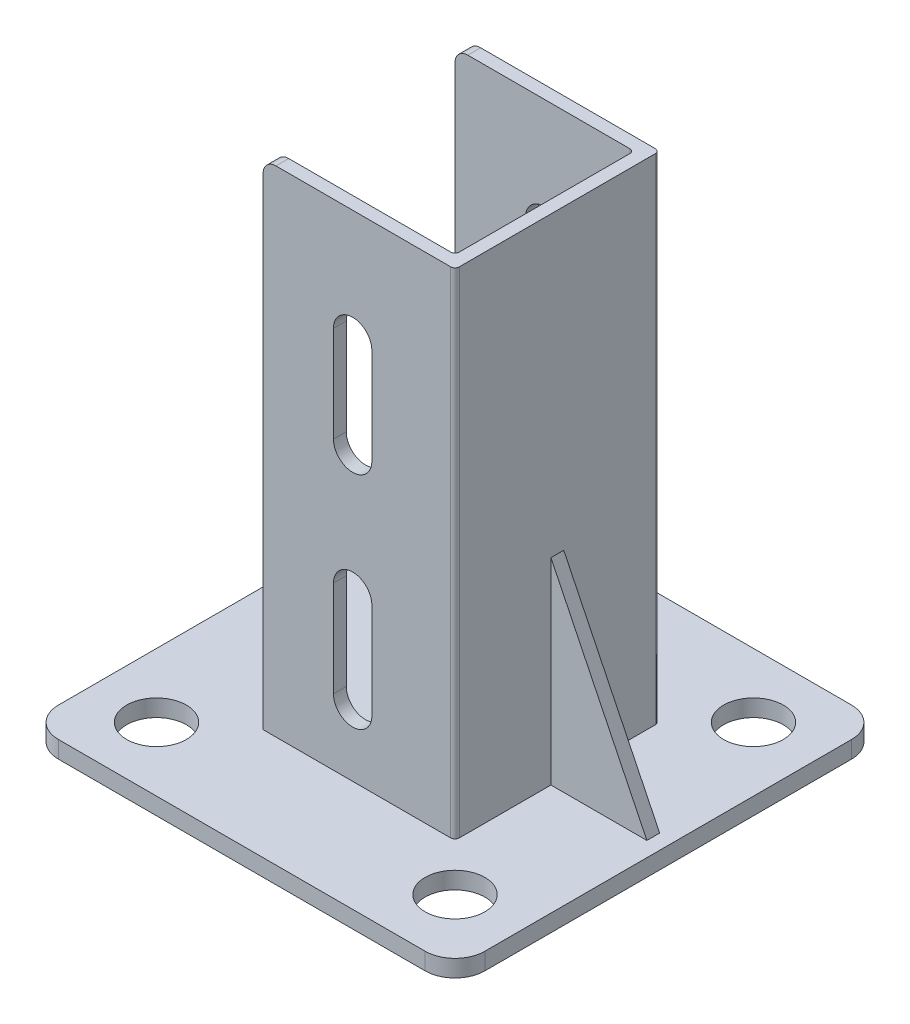
from build123d import *

# Parameters (mm, degrees)
SKETCH_1_W          = 99.999995276
SKETCH_1_H          = 99.999995276
SKETCH_1_R          = 7
EXTRUDE_2_DEPTH     = 4
FILLET_2_R          = 7
EXTRUDE_3_DEPTH     = 116
FILLET_3_R          = 3
FILLET_4_R          = 1
CUT_EXTRUDE_1_DEPTH = 116
RIB_1_REACH         = 141.284
SKETCH_6_WALL_W     = 331.945026876
SKETCH_6_WALL_H     = 3


with BuildPart() as part:
    # 草图1 → 凸台-拉伸2 (new body)
    with BuildSketch(Plane(origin=(0, 0, 0), x_dir=(1, 0, 0), z_dir=(0, 1, 0))):
        Rectangle(SKETCH_1_W, SKETCH_1_H)
        with Locations(Location((-35, 35, 0), (0, 0, 270))):
            Circle(SKETCH_1_R, mode=Mode.SUBTRACT)
        with Locations(Location((35, 35, 0), (0, 0, 270))):
            Circle(SKETCH_1_R, mode=Mode.SUBTRACT)
        with Locations(Location((35, -35, 0), (0, 0, 270))):
            Circle(SKETCH_1_R, mode=Mode.SUBTRACT)
        with Locations(Location((-35, -35, 0), (0, 0, 270))):
            Circle(SKETCH_1_R, mode=Mode.SUBTRACT)
    extrude(amount=EXTRUDE_2_DEPTH)

    # 圆角2
    fillet_2_edges = [part.edges().sort_by_distance(p)[0] for p in [
        (-49.999997638, 2, -49.999997638),
        (49.999997638, 2, -49.999997638),
        (49.999997638, 2, 49.999997638),
        (-49.999997638, 2, 49.999997638),
    ]]
    fillet(fillet_2_edges, radius=FILLET_2_R)

    # 草图3 → 凸台-拉伸3 (add)
    with BuildSketch(Plane(origin=(0, 4, 0), x_dir=(1, 0, 0), z_dir=(0, 1, 0))):
        Polygon((-21, -24), (-21, -21), (21, -21), (21, 21), (-21, 21), (-21, 24), (24, 24), (24, -24), align=None)
    extrude(amount=EXTRUDE_3_DEPTH)

    # 圆角3
    fillet_3_edges = [part.edges().sort_by_distance(p)[0] for p in [
        (-21, 120, 22.5),
        (-21, 120, -22.5),
    ]]
    fillet(fillet_3_edges, radius=FILLET_3_R)

    # 圆角4
    fillet_4_edges = [part.edges().sort_by_distance(p)[0] for p in [
        (24, 62, 24),
        (24, 62, -24),
        (21, 62, -21),
        (21, 62, 21),
    ]]
    fillet(fillet_4_edges, radius=FILLET_4_R)

    # 草图4 → 切除-拉伸1 (cut)
    with BuildSketch(Plane(origin=(0, 0, -24), x_dir=(-1, 0, 0), z_dir=(0, 0, -1))):
        with BuildLine():
            Line((4.5, 93.761812865), (4.5, 71.261812865))
            ThreePointArc((4.5, 71.261812865), (0, 66.761812865), (-4.5, 71.261812865))
            Line((-4.5, 71.261812865), (-4.5, 93.761812865))
            ThreePointArc((-4.5, 93.761812865), (0, 98.261812865), (4.5, 93.761812865))
        make_face()
        with BuildLine():
            Line((4.5, 42.026719912), (4.5, 19.526719912))
            ThreePointArc((4.5, 19.526719912), (0, 15.026719912), (-4.5, 19.526719912))
            Line((-4.5, 19.526719912), (-4.5, 42.026719912))
            ThreePointArc((-4.5, 42.026719912), (0, 46.526719912), (4.5, 42.026719912))
        make_face()
    extrude(amount=-CUT_EXTRUDE_1_DEPTH, mode=Mode.SUBTRACT)

    # 草图6 wall → 筋1 (add, up to next)
    with BuildSketch(Plane(origin=(35.249998819, 27.094227832, 0), x_dir=(0.437936853183, -0.89900573559, 0), z_dir=(0.89900573559, 0.437936853183, 0)), mode=Mode.PRIVATE) as rib_1_sk1:
        Rectangle(SKETCH_6_WALL_W, SKETCH_6_WALL_H)
    rib_1_tool1 = extrude(rib_1_sk1.sketch, amount=-RIB_1_REACH, mode=Mode.PRIVATE) - part.part
    add(rib_1_tool1.solids().sort_by_distance((35.249998819, 27.094227832, 0))[0])


solid = part.part
